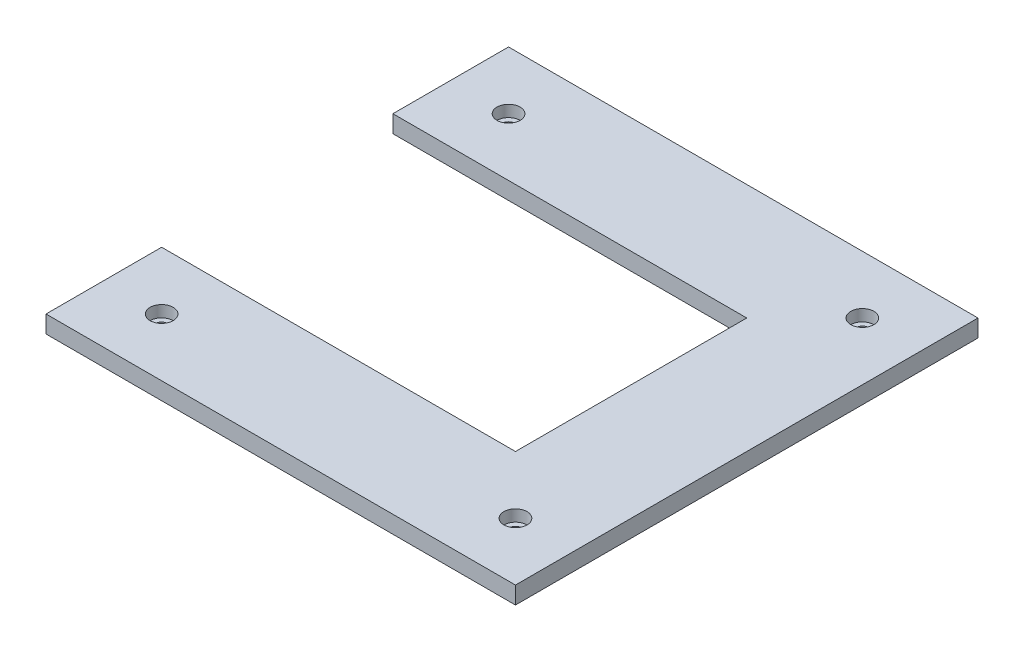
from build123d import *

# Parameters (mm, degrees)
EXTRUDE_THIN1_DEPTH            = 6
CBORE_FOR_M4_SHCS1_D           = 4.5
CBORE_FOR_M4_SHCS1_CBORE_D     = 8
CBORE_FOR_M4_SHCS1_CBORE_DEPTH = 4


with BuildPart() as part:
    # Sketch1 → Extrude-Thin1 (new body)
    with BuildSketch(Plane(origin=(0, 0, 0), x_dir=(1, 0, 0), z_dir=(0, 1, 0))):
        Polygon((-162.4, 80), (0, 80), (0, -80), (-162.4, -80), (-162.4, -40), (-40, -40), (-40, 40), (-162.4, 40), align=None)
    extrude(amount=EXTRUDE_THIN1_DEPTH)

    # CBORE for M4 SHCS1 (through all)
    with Locations(Plane(origin=(0, 6, 0), x_dir=(1, 0, 0), z_dir=(0, 1, 0))):
        with Locations((-20, -60), (-142.4, 60), (-142.4, -60), (-20, 60)):
            CounterBoreHole(CBORE_FOR_M4_SHCS1_D / 2, CBORE_FOR_M4_SHCS1_CBORE_D / 2, CBORE_FOR_M4_SHCS1_CBORE_DEPTH)


solid = part.part
